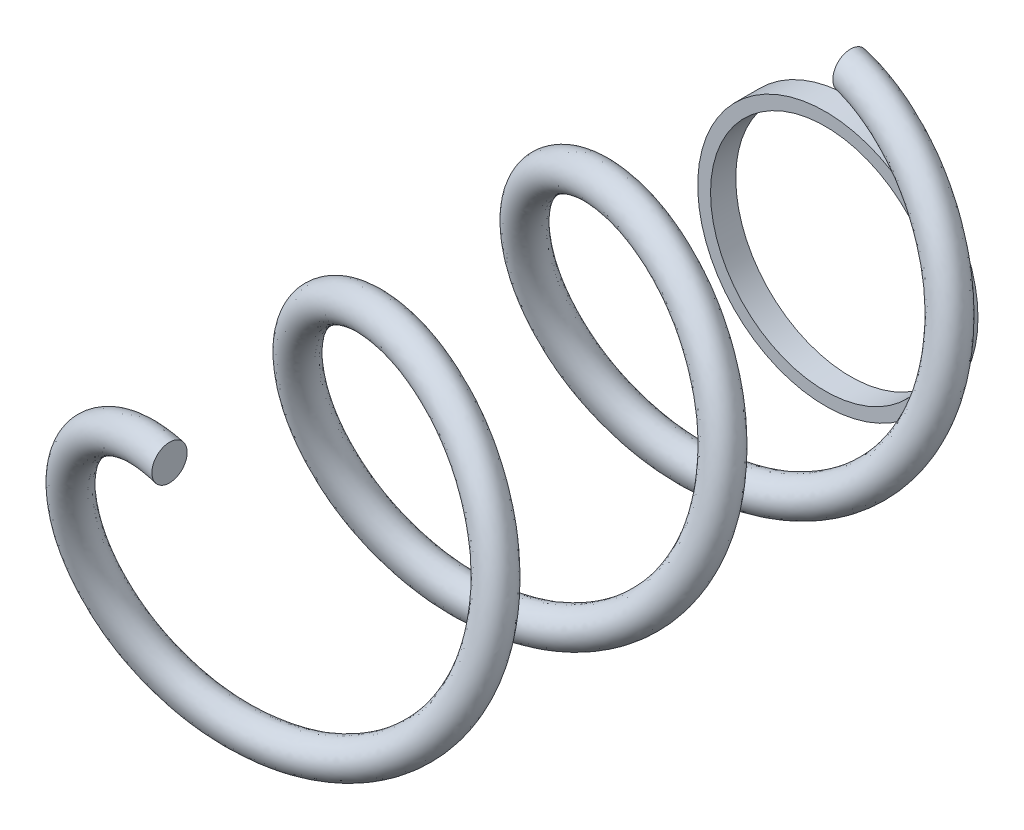
from build123d import *

# Parameters (mm, degrees)
BALAYAGE1_PITCH       = 4.5
BALAYAGE1_HEIGHT      = 13.5
BALAYAGE1_RADIUS      = 3
BALAYAGE1_START_ANGLE = 90
ESQUISSE2_R           = 0.35
ESQUISSE3_R           = 2.528279304
ESQUISSE3_R_2         = 2.274083759
BOSS_EXTRU_1_DEPTH    = 0.5


with BuildPart() as part:
    # Balayage1: sweep along a helix
    with BuildLine() as balayage1_path:
        add(Helix(BALAYAGE1_PITCH, BALAYAGE1_HEIGHT, BALAYAGE1_RADIUS, center=(0, 0, 0), direction=(0, 0, 1), lefthand=True, mode=Mode.PRIVATE).rotate(Axis((0, 0, 0), (0, 0, 1)), BALAYAGE1_START_ANGLE))
    # Esquisse2 → Balayage1 (sweep)
    with BuildSketch(Plane(origin=(0, 0, 0), x_dir=(0, 0, -1), z_dir=(1, 0, 0))):
        with Locations((0, 3)):
            Circle(ESQUISSE2_R)
    sweep(path=balayage1_path.line, is_frenet=True)


with BuildPart() as body_2:
    # Esquisse3 → Boss.-Extru.1 (new body)
    with BuildSketch(Plane.XY):
        Circle(ESQUISSE3_R)
        Circle(ESQUISSE3_R_2, mode=Mode.SUBTRACT)
    extrude(amount=BOSS_EXTRU_1_DEPTH)


solid = Compound([part.part, body_2.part])
